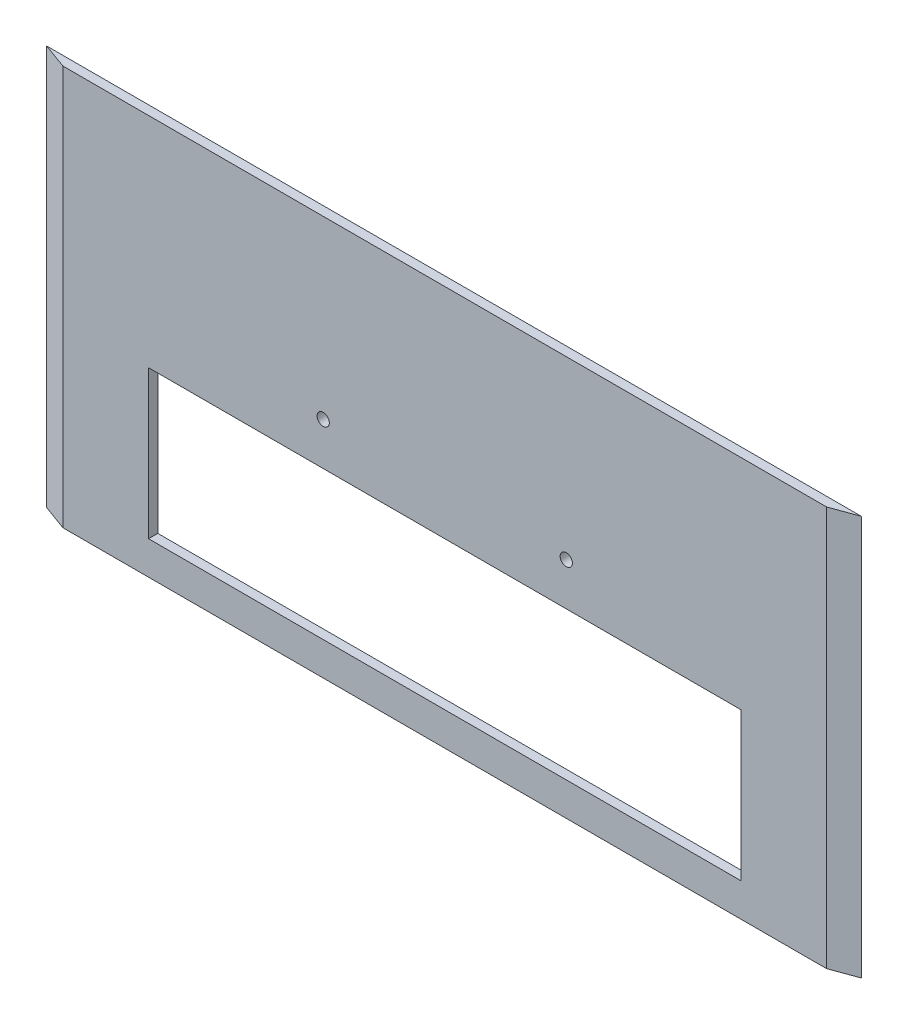
from build123d import *

# Parameters (mm, degrees)
SKETCH1_W           = 175
SKETCH1_H           = 63
BOSS_EXTRUDE1_DEPTH = 2.5
SKETCH2_W           = 160
SKETCH2_H           = 40
CUT_EXTRUDE1_DEPTH  = 2.5
SKETCH5_W           = 175
SKETCH5_H           = 45
BOSS_EXTRUDE3_DEPTH = 2.5
BOSS_EXTRUDE2_DEPTH = 108
SKETCH4_R           = 1.65
CUT_EXTRUDE2_DEPTH  = 135.009328034


with BuildPart() as part:
    # Sketch1 → Boss-Extrude1 (new body)
    with BuildSketch(Plane.XY):
        Rectangle(SKETCH1_W, SKETCH1_H)
    extrude(amount=BOSS_EXTRUDE1_DEPTH)

    # Sketch2 → Cut-Extrude1 (cut)
    with BuildSketch(Plane.XY.offset(2.5)):
        with Locations((0, -2.5)):
            Rectangle(SKETCH2_W, SKETCH2_H)
    extrude(amount=-CUT_EXTRUDE1_DEPTH, mode=Mode.SUBTRACT)

    # Sketch5 → Boss-Extrude3 (add)
    with BuildSketch(Plane.XY.offset(2.5)):
        with Locations((0, 54)):
            Rectangle(SKETCH5_W, SKETCH5_H)
    extrude(amount=-BOSS_EXTRUDE3_DEPTH)

    # Sketch3 → Boss-Extrude2 (add)
    with BuildSketch(Plane(origin=(0, -31.5, 0), x_dir=(1, 0, 0), z_dir=(0, 1, 0))):
        Polygon((-87.5, -2.5), (-103.131306451, -2.5), (-110, 0), (-87.5, 0), align=None)
    boss_extrude2 = extrude(amount=BOSS_EXTRUDE2_DEPTH)

    # Mirror1: Boss-Extrude2 across plane
    add(boss_extrude2.mirror(Plane(origin=(0, 0, 0), x_dir=(0, 0, 1), z_dir=(1, 0, 0))))

    # Sketch4 → Cut-Extrude2 (cut, through all)
    with BuildSketch(Plane(origin=(0, 0, 0), x_dir=(-1, 0, 0), z_dir=(0, 0, -1))):
        with Locations((-32.825, 29)):
            Circle(SKETCH4_R)
    cut_extrude2 = extrude(amount=-CUT_EXTRUDE2_DEPTH, mode=Mode.SUBTRACT)

    # Mirror2: Cut-Extrude2 across plane
    add(cut_extrude2.mirror(Plane(origin=(0, 0, 0), x_dir=(0, 0, 1), z_dir=(1, 0, 0))), mode=Mode.SUBTRACT)


solid = part.part
